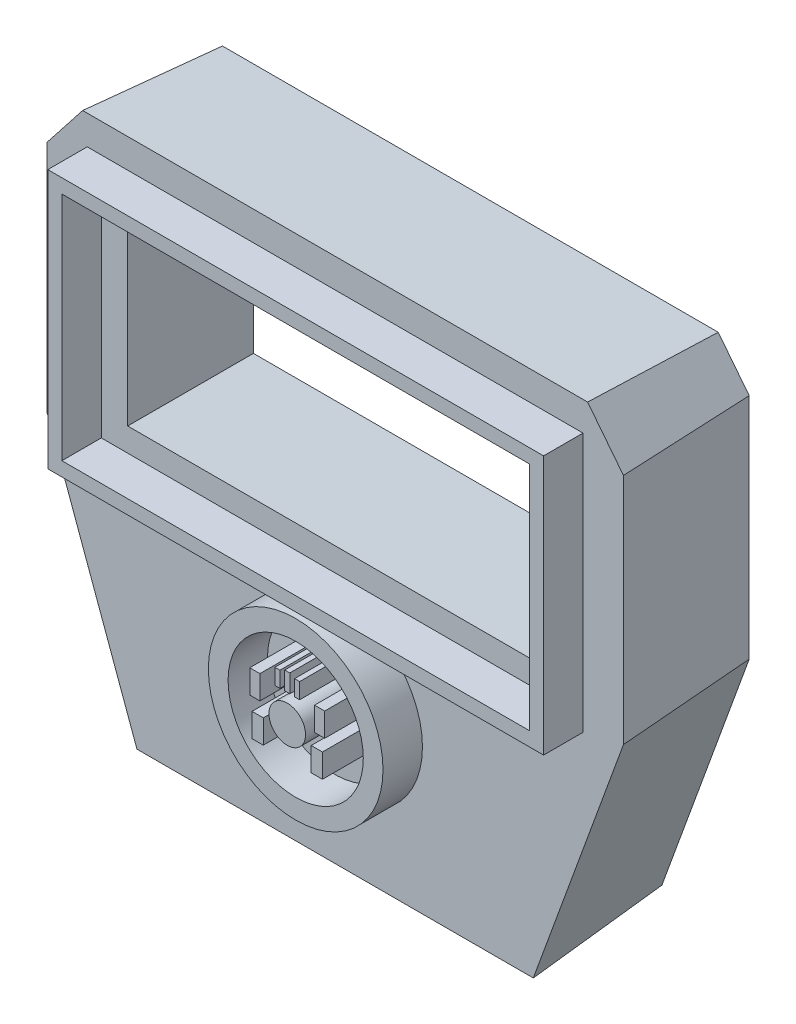
from build123d import *

# Parameters (mm, degrees)
SKETCH1_W           = 154
SKETCH1_H           = 72
BOSS_EXTRUDE1_DEPTH = 48
BOSS_EXTRUDE1_DRAFT = -4
SKETCH2_R           = 31
SKETCH2_R_2         = 24
SKETCH2_W           = 176
SKETCH2_H           = 92
SKETCH2_W_2         = 166
SKETCH2_H_2         = 82
BOSS_EXTRUDE2_DEPTH = 62
SKETCH3_R           = 6.5
SKETCH3_W           = 1.8
SKETCH3_H           = 5.6
SKETCH3_H_2         = 6.4
SKETCH3_W_2         = 3.6
SKETCH3_H_3         = 8.4
SKETCH3_W_3         = 4
BOSS_EXTRUDE3_DEPTH = 65


with BuildPart() as part:
    # Sketch1 → Boss-Extrude1 (with draft: the straight prism first)
    with BuildSketch(Plane.XY):
        Polygon((-88, 90), (-99, 76), (-99, -5), (-68, -90), (68, -90), (99, -5), (99, 76), (88, 90), align=None)
        with Locations((0, 37)):
            Rectangle(SKETCH1_W, SKETCH1_H, mode=Mode.SUBTRACT)
    extrude(amount=BOSS_EXTRUDE1_DEPTH)
    # Boss-Extrude1: the draft: its side faces are tilted about the plane it starts from
    boss_extrude1_sides = [part.faces().sort_by_distance(p)[0] for p in [
        (-93.5, 83, 24),
        (-99, 35.5, 24),
        (-83.5, -47.5, 24),
        (0, -90, 24),
        (83.5, -47.5, 24),
        (99, 35.5, 24),
        (93.5, 83, 24),
        (0, 90, 24),
        (-77, 37, 24),
        (0, 73, 24),
        (77, 37, 24),
        (0, 1, 24),
    ]]
    draft(boss_extrude1_sides, Plane.XY, BOSS_EXTRUDE1_DRAFT)

    # Sketch2 → Boss-Extrude2 (add)
    # profile 1 of 2: a face of its own
    with BuildSketch(Plane.XY):
        with Locations(Location((0, -42, 0), (0, 0, 180))):
            Circle(SKETCH2_R)
        with Locations(Location((0, -42, 0), (0, 0, 180))):
            Circle(SKETCH2_R_2, mode=Mode.SUBTRACT)
    # profile 2 of 2: a face of its own
    with BuildSketch(Plane.XY):
        with Locations((0, 37)):
            Rectangle(SKETCH2_W, SKETCH2_H)
        with Locations((0, 37)):
            Rectangle(SKETCH2_W_2, SKETCH2_H_2, mode=Mode.SUBTRACT)
    extrude(amount=BOSS_EXTRUDE2_DEPTH)

    # Sketch3 → Boss-Extrude3 (add)
    with BuildSketch(Plane.XY):
        with Locations(Location((0, -42, 0), (0, 0, 180))):
            Circle(SKETCH3_R)
        with Locations((-3.5, -29.5)):
            Rectangle(SKETCH3_W, SKETCH3_H)
        with Locations((0, -29)):
            Rectangle(SKETCH3_W, SKETCH3_H_2)
        with Locations((3.5, -29.5)):
            Rectangle(SKETCH3_W, SKETCH3_H)
        with Locations((-11.5, -35.5)):
            Rectangle(SKETCH3_W_2, SKETCH3_H_3)
        with Locations((11.5, -35.5)):
            Rectangle(SKETCH3_W_2, SKETCH3_H_3)
        with Locations((-10.5, -48.5)):
            Rectangle(SKETCH3_W_3, SKETCH3_H_3)
        with Locations((10.5, -48.5)):
            Rectangle(SKETCH3_W_3, SKETCH3_H_3)
    extrude(amount=BOSS_EXTRUDE3_DEPTH)


solid = part.part
